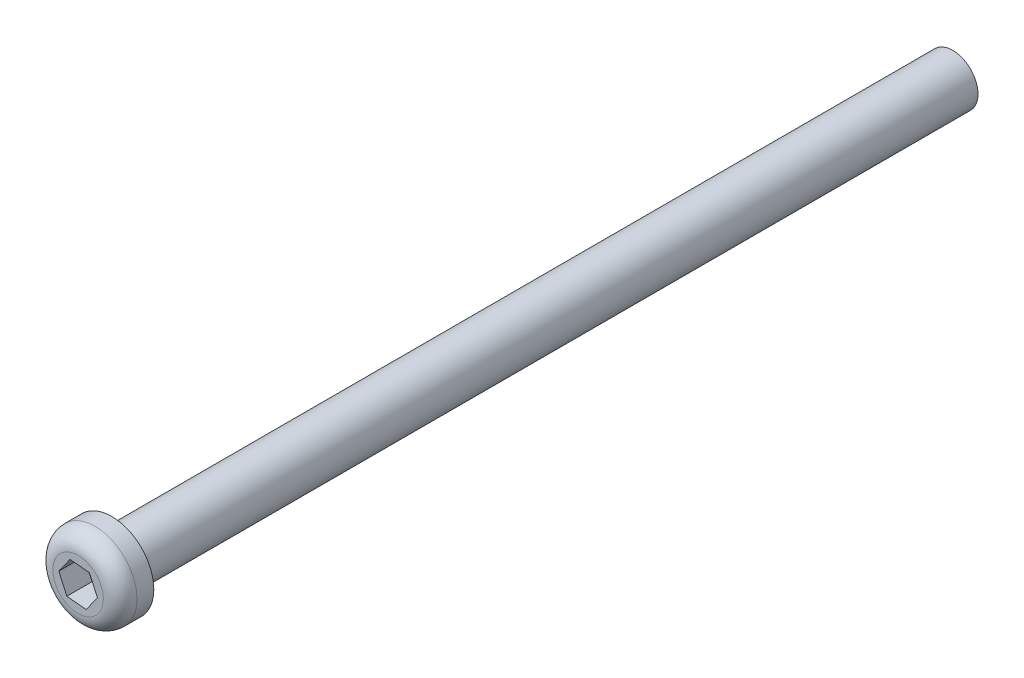
from build123d import *

# Parameters (mm, degrees)
SKETCH_1_R          = 1.5
EXTRUDE_1_DEPTH     = 50
SKETCH_2_R          = 2.5
EXTRUDE_2_DEPTH     = 2
CUT_EXTRUDE_1_DEPTH = 1.5
FILLET_2_R          = 1


with BuildPart() as part:
    # 草图1 → 凸台-拉伸1 (new body)
    with BuildSketch(Plane.XY):
        Circle(SKETCH_1_R)
    extrude(amount=EXTRUDE_1_DEPTH)

    # 草图2 → 凸台-拉伸2 (add)
    with BuildSketch(Plane.XY.offset(50)):
        Circle(SKETCH_2_R)
    extrude(amount=EXTRUDE_2_DEPTH)

    # 草图3 → 切除-拉伸1 (cut)
    with BuildSketch(Plane.XY.offset(52)):
        Polygon((1.149641735, -0.107968584), (0.668324404, 0.941634655), (-0.481317331, 1.04960324), (-1.149641735, 0.107968584), (-0.668324404, -0.941634655), (0.481317331, -1.04960324), align=None)
    extrude(amount=-CUT_EXTRUDE_1_DEPTH, mode=Mode.SUBTRACT)

    # 圆角2
    fillet_2_edges = [part.edges().sort_by_distance(p)[0] for p in [
        (-2.5, 0, 52),
    ]]
    fillet(fillet_2_edges, radius=FILLET_2_R)


solid = part.part
